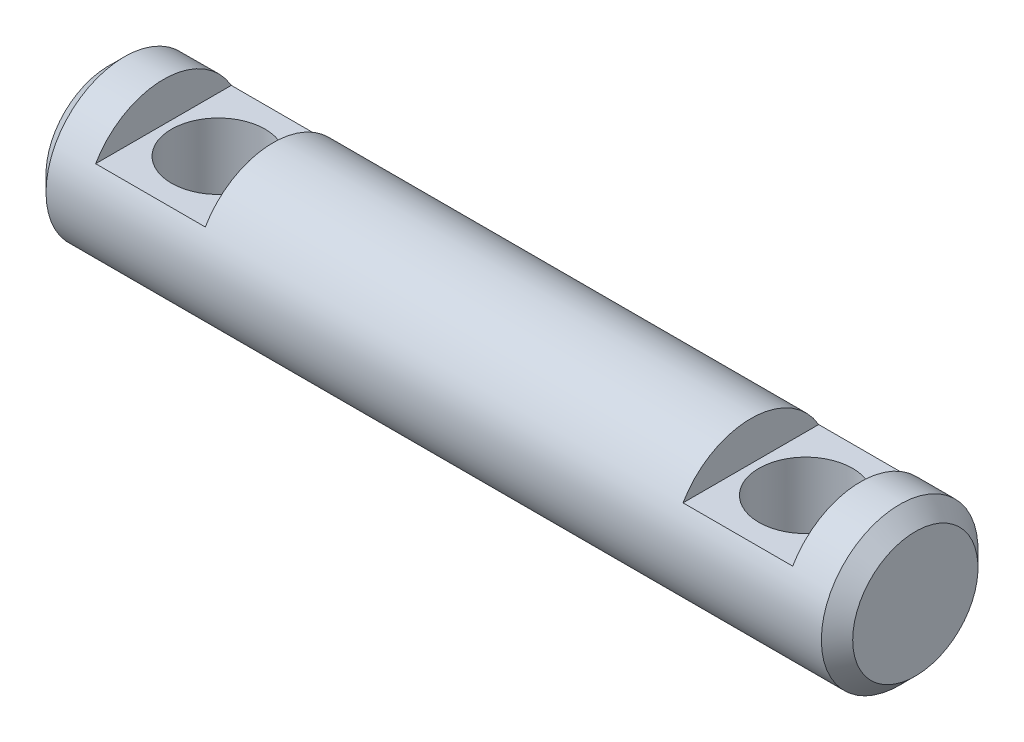
from build123d import *

# Parameters (mm, degrees)
SKETCH1_W               = 103
SKETCH1_H               = 10
CUT_EXTRUDE1_START      = -7
CUT_EXTRUDE1_DEPTH      = 14
CUT_EXTRUDE2_START      = -7
CUT_EXTRUDE2_DEPTH      = 14
CUT_EXTRUDE3_DEPTH      = 104.966340707
CUT_EXTRUDE3_DEPTH_BACK = 104.966340707
SKETCH4_R               = 5.983
CHAMFER1_SIZE           = 2


with BuildPart() as part:
    # Sketch1 → Revolve1 (revolve)
    with BuildSketch(Plane.XY, mode=Mode.PRIVATE) as revolve1_sk:
        with Locations((-51.5, 5)):
            Rectangle(SKETCH1_W, SKETCH1_H)
    revolve(revolve1_sk.sketch.rotate(Axis((-103, 0, 0), (1, 0, 0)), 90), axis=Axis((-103, 0, 0), (1, 0, 0)))

    # Sketch2 → Cut-Extrude1 (cut)
    with BuildSketch(Plane(origin=(0, 0, 0), x_dir=(0, 0, -1), z_dir=(1, 0, 0)).offset(CUT_EXTRUDE1_START)):
        with BuildLine():
            Line((-10.872335562, 5), (10.872335562, 5))
            ThreePointArc((10.872335562, 5), (0, 11.966941154), (-10.872335562, 5))
        make_face()
    extrude(amount=-CUT_EXTRUDE1_DEPTH, mode=Mode.SUBTRACT)

    # Sketch3 → Cut-Extrude2 (cut)
    with BuildSketch(Plane.ZY.offset(103).offset(CUT_EXTRUDE2_START)):
        with BuildLine():
            Line((-15, 5), (15, 5))
            ThreePointArc((15, 5), (0, 15.811388301), (-15, 5))
        make_face()
    extrude(amount=-CUT_EXTRUDE2_DEPTH, mode=Mode.SUBTRACT)

    # Sketch4 → Cut-Extrude3 (cut, two sides: drawn at the far end of the back side and taken through both)
    with BuildSketch(Plane(origin=(0, 0, 0), x_dir=(1, 0, 0), z_dir=(0, 1, 0)).offset(-CUT_EXTRUDE3_DEPTH_BACK)):
        with Locations(Location((-89, 0, 0), (0, 0, 270))):
            Circle(SKETCH4_R)
        with Locations(Location((-14, 0, 0), (0, 0, 270))):
            Circle(SKETCH4_R)
    extrude(amount=CUT_EXTRUDE3_DEPTH + CUT_EXTRUDE3_DEPTH_BACK, mode=Mode.SUBTRACT)

    # Chamfer1
    chamfer1_edges = [part.edges().sort_by_distance(p)[0] for p in [
        (0, 0, -10),
        (-103, 0, -10),
    ]]
    chamfer(chamfer1_edges, length=CHAMFER1_SIZE)


solid = part.part
